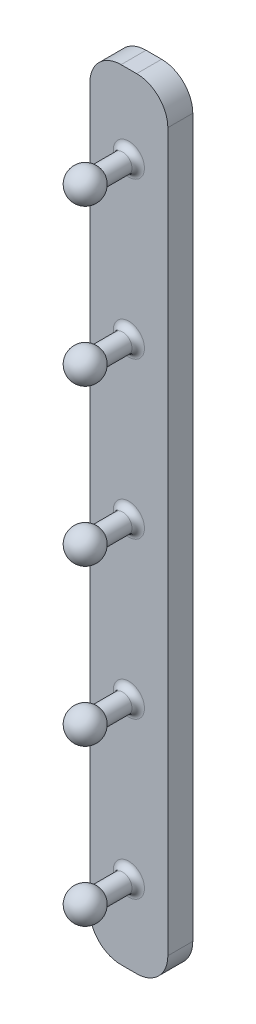
from build123d import *

# Parameters (mm, degrees)
SALIENTE_EXTRUIR1_DEPTH     = 8
CROQUIS2_R                  = 3
SALIENTE_EXTRUIR2_DEPTH     = 10
REDONDEO1_R                 = 2
MATRIZL3_COUNT              = 3
MATRIZL3_PITCH              = 50
REDONDEO1_OF_MATRIZL3_R     = 2
MATRIZL3_COL_COUNT          = 3
MATRIZL3_COL_PITCH          = 50
REDONDEO1_OF_MATRIZL3_COL_R = 2


with BuildPart() as part:
    # Croquis1 → Saliente-Extruir1 (new body)
    with BuildSketch(Plane(origin=(0, 0, 0), x_dir=(0, 1, 0), z_dir=(0, 0, 1))):
        with BuildLine():
            Line((-115, 12.5), (115, 12.5))
            ThreePointArc((115, 12.5), (122.071067812, 9.571067812), (125, 2.5))
            Line((125, 2.5), (125, -2.5))
            ThreePointArc((125, -2.5), (122.071067812, -9.571067812), (115, -12.5))
            Line((115, -12.5), (-115, -12.5))
            ThreePointArc((-115, -12.5), (-122.071067812, -9.571067812), (-125, -2.5))
            Line((-125, -2.5), (-125, 2.5))
            ThreePointArc((-125, 2.5), (-122.071067812, 9.571067812), (-115, 12.5))
        make_face()
    extrude(amount=SALIENTE_EXTRUIR1_DEPTH)

    # Croquis2 → Saliente-Extruir2 (add)
    with BuildSketch(Plane.XY.offset(8)):
        Circle(CROQUIS2_R)
    saliente_extruir2 = extrude(amount=SALIENTE_EXTRUIR2_DEPTH)

    # Croquis3 → Revolución1 (revolve)
    with BuildSketch(Plane.YZ, mode=Mode.PRIVATE) as revoluci_n1_sk:
        with BuildLine():
            Line((-3, 18), (0, 18))
            Line((0, 18), (0, 27))
            ThreePointArc((0, 27), (-4.74341649, 23.58113883), (-3, 18))
        make_face()
    revoluci_n1 = revolve(revoluci_n1_sk.sketch.rotate(Axis((0, 0, 18), (0, 0, 1)), 180), axis=Axis((0, 0, 18), (0, 0, 1)))

    # Redondeo1
    redondeo1_edges = [part.edges().sort_by_distance(p)[0] for p in [
        (-3, 0, 8),
    ]]
    fillet(redondeo1_edges, radius=REDONDEO1_R)

    # MatrizL3: Saliente-Extruir2, Revolución1 ×3
    with Locations(*[(0, i * MATRIZL3_PITCH, 0) for i in range(1, MATRIZL3_COUNT)]):
        add(saliente_extruir2)
        add(revoluci_n1)

    # Redondeo1 of MatrizL3
    redondeo1_of_matrizl3_edges = [part.edges().sort_by_distance(p)[0] for p in [
        (-3, 50, 8),
        (-3, 100, 8),
    ]]
    fillet(redondeo1_of_matrizl3_edges, radius=REDONDEO1_OF_MATRIZL3_R)

    # MatrizL3 col: Saliente-Extruir2, Revolución1 ×3
    with Locations(*[(0, -i * MATRIZL3_COL_PITCH, 0) for i in range(1, MATRIZL3_COL_COUNT)]):
        add(saliente_extruir2)
        add(revoluci_n1)

    # Redondeo1 of MatrizL3 col
    redondeo1_of_matrizl3_col_edges = [part.edges().sort_by_distance(p)[0] for p in [
        (-3, -50, 8),
        (-3, -100, 8),
    ]]
    fillet(redondeo1_of_matrizl3_col_edges, radius=REDONDEO1_OF_MATRIZL3_COL_R)


solid = part.part
